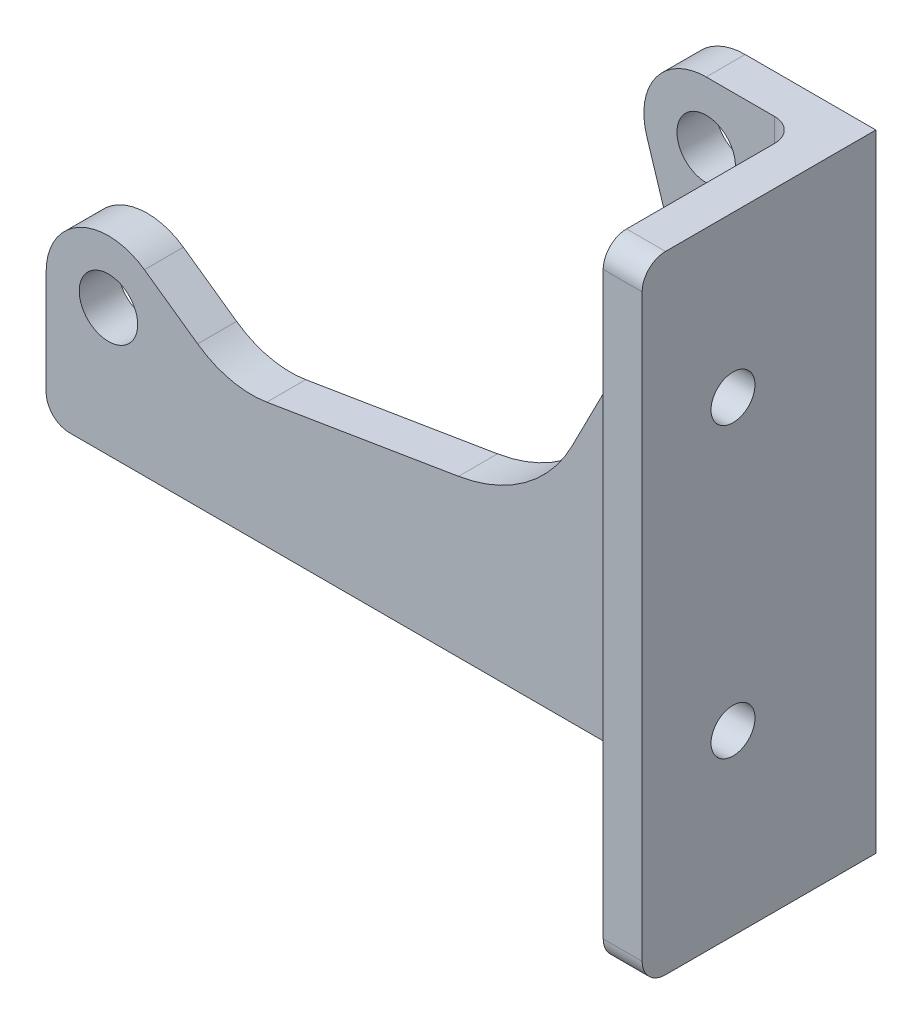
from build123d import *

# Parameters (mm, degrees)
SKETCH1_W           = 237.666601654
SKETCH1_H           = 144.870829151
BOSS_EXTRUDE1_DEPTH = 6.35
SKETCH6_R           = 4.7625
CUT_EXTRUDE1_DEPTH  = 279.412092375
BOSS_EXTRUDE2_DEPTH = 31.75
SKETCH8_R           = 3.5814
CUT_EXTRUDE2_DEPTH  = 165.026783357
FILLET1_R           = 3.81


with BuildPart() as part:
    # Sketch1 → Boss-Extrude1 (new body)
    with BuildSketch(Plane.XY):
        with Locations((118.833300827, 72.435414576)):
            Rectangle(SKETCH1_W, SKETCH1_H)
    extrude(amount=BOSS_EXTRUDE1_DEPTH)

    # Sketch6 → Cut-Extrude1 (cut, through all)
    with BuildSketch(Plane(origin=(0, 0, 0), x_dir=(-1, 0, 0), z_dir=(0, 0, -1))):
        with Locations((-216.35760516, 91.973324775)):
            Circle(SKETCH6_R)
        with Locations(Location((-118.912497493, 20.833508274, 0), (0, 0, 180))):
            Circle(SKETCH6_R)
        with BuildLine():
            Line((-237.666601654, 102.132216913), (-216.358133389, 102.133324761))
            ThreePointArc((-216.358133389, 102.133324761), (-208.163913134, 97.980737777), (-206.668218378, 88.91695703))
            Line((-206.668218378, 88.91695703), (-209.863652574, 78.786697699))
            ThreePointArc((-209.863652574, 78.786697699), (-210.516155402, 72.927274811), (-208.895904566, 67.258643251))
            Line((-208.895904566, 67.258643251), (-194.461394125, 39.056254914))
            ThreePointArc((-194.461394125, 39.056254914), (-186.82764399, 30.114000126), (-175.984822796, 25.567431049))
            Line((-175.984822796, 25.567431049), (-144.725556293, 20.41107019))
            ThreePointArc((-144.725556293, 20.41107019), (-138.832778099, 20.5948137), (-133.450682209, 23.001396414))
            Line((-133.450682209, 23.001396414), (-124.775487304, 29.13115556))
            ThreePointArc((-124.775487304, 29.13115556), (-114.240366099, 29.855525136), (-108.752497493, 20.833508274))
            Line((-108.752497493, 20.833508274), (-108.752497493, 0))
            Line((-108.752497493, 0), (33.78855799, -29.414686869))
            Line((33.78855799, -29.414686869), (48.645656143, 190.527142522))
            Line((48.645656143, 190.527142522), (-347.111633803, 192.661310616))
            Line((-347.111633803, 192.661310616), (-237.666601654, 102.132216913))
        make_face()
    extrude(amount=-CUT_EXTRUDE1_DEPTH, mode=Mode.SUBTRACT)

    # Sketch7 → Boss-Extrude2 (add)
    with BuildSketch(Plane.XY.offset(6.35)):
        Polygon((231.316601654, 102.132547055), (237.666601654, 102.132216913), (237.666601654, 0), (231.316601654, 0), align=None)
    extrude(amount=BOSS_EXTRUDE2_DEPTH)

    # Sketch8 → Cut-Extrude2 (cut, through all)
    with BuildSketch(Plane.ZY.offset(-231.316601654)):
        with Locations((23.289062999, 76.03064494)):
            Circle(SKETCH8_R)
        with Locations((23.289062999, 28.982263142)):
            Circle(SKETCH8_R)
    extrude(amount=-CUT_EXTRUDE2_DEPTH, mode=Mode.SUBTRACT)

    # Fillet1
    fillet1_edges = [part.edges().sort_by_distance(p)[0] for p in [
        (108.752497493, 0, 3.175),
        (231.316601654, 51.066273528, 6.35),
        (234.491601654, 0, 38.1),
        (234.491601654, 102.132381984, 38.1),
    ]]
    fillet(fillet1_edges, radius=FILLET1_R)


solid = part.part
